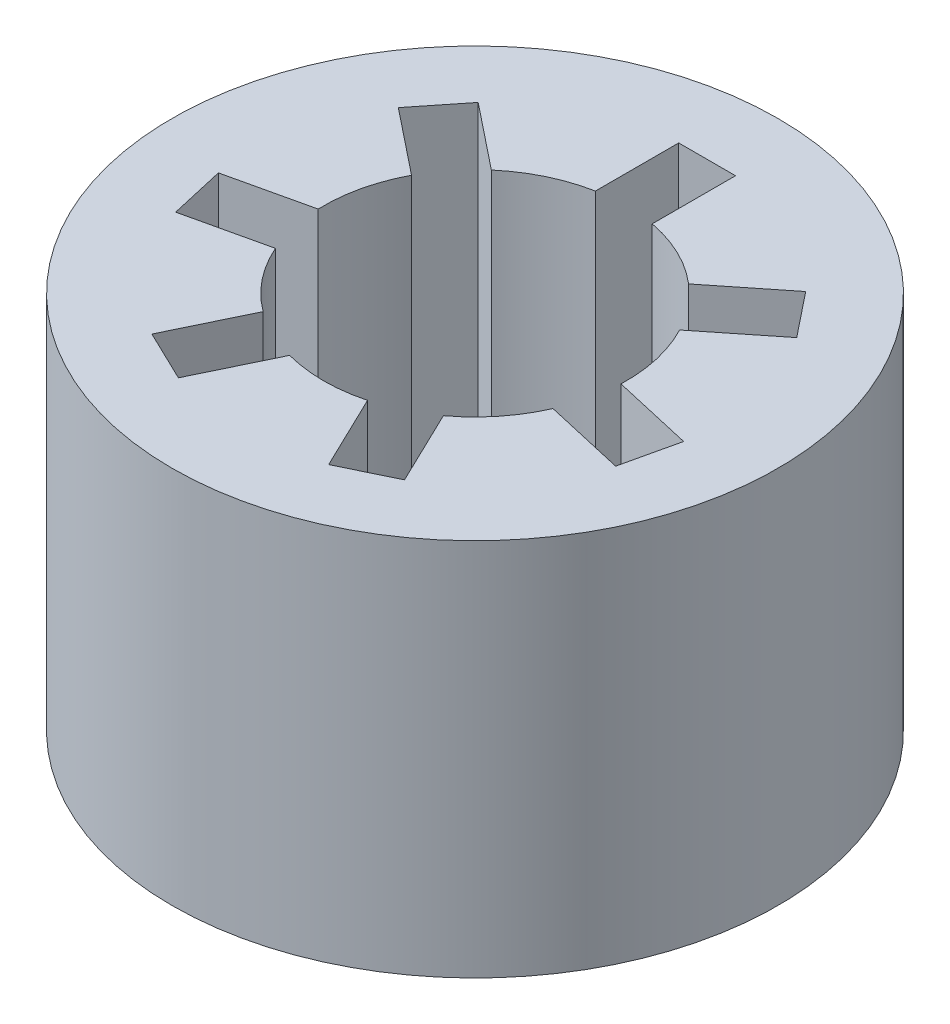
from build123d import *

# Parameters (mm, degrees)
CASING_R            = 8
CASING_R_2          = 4
BOSS_EXTRUDE1_DEPTH = 10
CUT_EXTRUDE1_REACH  = 17.1
NOTCH_W             = 1.5
NOTCH_H             = 2.2


with BuildPart() as part:
    # Casing → Boss-Extrude1 (new body)
    with BuildSketch(Plane(origin=(0, 0, 0), x_dir=(1, 0, 0), z_dir=(0, 1, 0))):
        with Locations(Location((0, 0, 0), (0, 0, 270))):
            Circle(CASING_R)
        with Locations(Location((0, 0, 0), (0, 0, 270))):
            Circle(CASING_R_2, mode=Mode.SUBTRACT)
    extrude(amount=BOSS_EXTRUDE1_DEPTH)

    # Notch → Cut-Extrude1 (cut, up to next)
    with BuildSketch(Plane(origin=(0, 0, 0), x_dir=(1, 0, 0), z_dir=(0, 1, 0)), mode=Mode.PRIVATE) as cut_extrude1_sk1:
        with Locations((0, 5.029058411)):
            Rectangle(NOTCH_W, NOTCH_H)
    cut_extrude1_tool1 = extrude(cut_extrude1_sk1.sketch, amount=CUT_EXTRUDE1_REACH, mode=Mode.PRIVATE) & part.part
    # Notch → Cut-Extrude1 (cut, up to next)
    with BuildSketch(Plane(origin=(0, 0, 0), x_dir=(1, 0, 0), z_dir=(0, 1, 0)), mode=Mode.PRIVATE) as cut_extrude1_sk2:
        Polygon((-2.604244211, 3.036101462), (-4.324273473, 4.407779026), (-5.259508175, 3.235031803), (-3.539478914, 1.863354239), align=None)
    cut_extrude1_tool2 = extrude(cut_extrude1_sk2.sketch, amount=CUT_EXTRUDE1_REACH, mode=Mode.PRIVATE) & part.part
    # Notch → Cut-Extrude1 (cut, up to next)
    with BuildSketch(Plane(origin=(0, 0, 0), x_dir=(1, 0, 0), z_dir=(0, 1, 0)), mode=Mode.PRIVATE) as cut_extrude1_sk3:
        Polygon((-3.997439414, -0.143101813), (-6.142280821, -0.632647868), (-5.80849942, -2.095039736), (-3.663658013, -1.605493681), align=None)
    cut_extrude1_tool3 = extrude(cut_extrude1_sk3.sketch, amount=CUT_EXTRUDE1_REACH, mode=Mode.PRIVATE) & part.part
    # Notch → Cut-Extrude1 (cut, up to next)
    with BuildSketch(Plane(origin=(0, 0, 0), x_dir=(1, 0, 0), z_dir=(0, 1, 0)), mode=Mode.PRIVATE) as cut_extrude1_sk4:
        Polygon((-2.380481206, -3.214546504), (-3.335025432, -5.196678014), (-1.98357213, -5.847503623), (-1.029027904, -3.865372113), align=None)
    cut_extrude1_tool4 = extrude(cut_extrude1_sk4.sketch, amount=CUT_EXTRUDE1_REACH, mode=Mode.PRIVATE) & part.part
    # Notch → Cut-Extrude1 (cut, up to next)
    with BuildSketch(Plane(origin=(0, 0, 0), x_dir=(1, 0, 0), z_dir=(0, 1, 0)), mode=Mode.PRIVATE) as cut_extrude1_sk5:
        Polygon((1.029027904, -3.865372113), (1.98357213, -5.847503623), (3.335025432, -5.196678014), (2.380481206, -3.214546504), align=None)
    cut_extrude1_tool5 = extrude(cut_extrude1_sk5.sketch, amount=CUT_EXTRUDE1_REACH, mode=Mode.PRIVATE) & part.part
    # Notch → Cut-Extrude1 (cut, up to next)
    with BuildSketch(Plane(origin=(0, 0, 0), x_dir=(1, 0, 0), z_dir=(0, 1, 0)), mode=Mode.PRIVATE) as cut_extrude1_sk6:
        Polygon((3.663658013, -1.605493681), (5.80849942, -2.095039736), (6.142280821, -0.632647868), (3.997439414, -0.143101813), align=None)
    cut_extrude1_tool6 = extrude(cut_extrude1_sk6.sketch, amount=CUT_EXTRUDE1_REACH, mode=Mode.PRIVATE) & part.part
    # Notch → Cut-Extrude1 (cut, up to next)
    with BuildSketch(Plane(origin=(0, 0, 0), x_dir=(1, 0, 0), z_dir=(0, 1, 0)), mode=Mode.PRIVATE) as cut_extrude1_sk7:
        Polygon((3.539478914, 1.863354239), (5.259508175, 3.235031803), (4.324273473, 4.407779026), (2.604244211, 3.036101462), align=None)
    cut_extrude1_tool7 = extrude(cut_extrude1_sk7.sketch, amount=CUT_EXTRUDE1_REACH, mode=Mode.PRIVATE) & part.part
    add(cut_extrude1_tool1.solids().sort_by_distance((0, 0, -5.029058))[0], mode=Mode.SUBTRACT)
    add(cut_extrude1_tool2.solids().sort_by_distance((-3.931876, 0, -3.135567))[0], mode=Mode.SUBTRACT)
    add(cut_extrude1_tool3.solids().sort_by_distance((-4.902969, 0, 1.119071))[0], mode=Mode.SUBTRACT)
    add(cut_extrude1_tool4.solids().sort_by_distance((-2.182027, 0, 4.531025))[0], mode=Mode.SUBTRACT)
    add(cut_extrude1_tool5.solids().sort_by_distance((2.182027, 0, 4.531025))[0], mode=Mode.SUBTRACT)
    add(cut_extrude1_tool6.solids().sort_by_distance((4.902969, 0, 1.119071))[0], mode=Mode.SUBTRACT)
    add(cut_extrude1_tool7.solids().sort_by_distance((3.931876, 0, -3.135567))[0], mode=Mode.SUBTRACT)


solid = part.part
